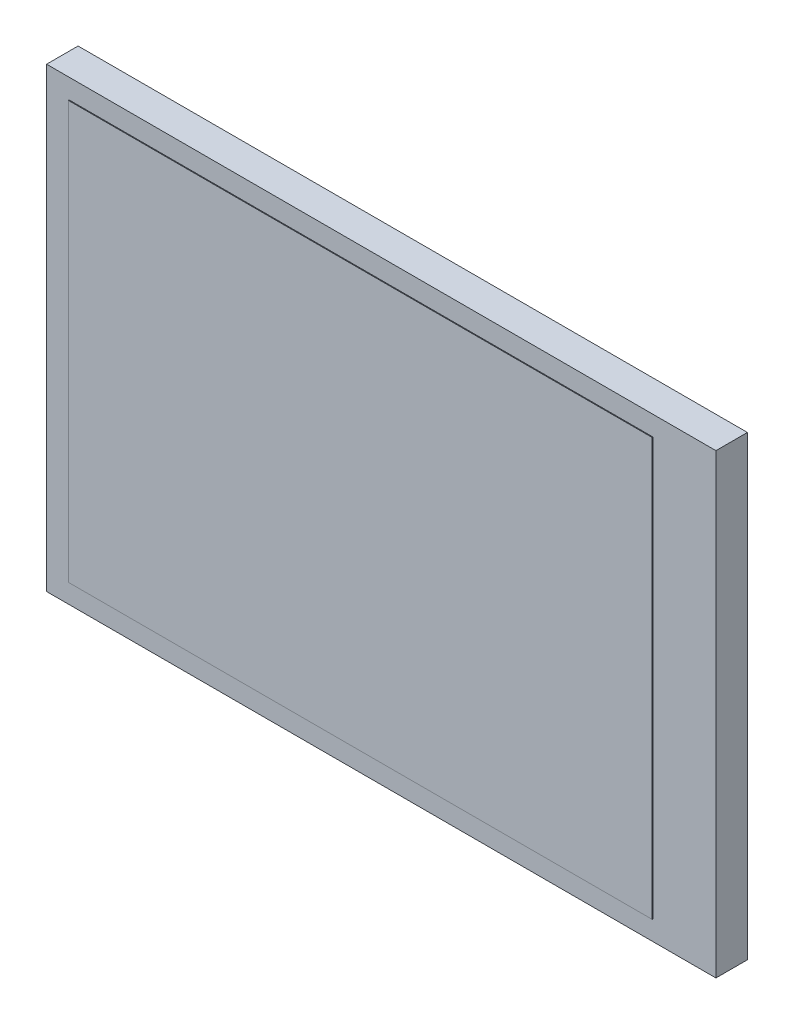
from build123d import *

# Parameters (mm, degrees)
SKETCH1_W           = 85
SKETCH1_H           = 58
BOSS_EXTRUDE1_DEPTH = 4
SKETCH2_W           = 74.144131661
SKETCH2_H           = 53
BOSS_EXTRUDE2_DEPTH = 0.1


with BuildPart() as part:
    # Sketch1 → Boss-Extrude1 (new body)
    with BuildSketch(Plane.XY):
        with Locations((-42.5, 29)):
            Rectangle(SKETCH1_W, SKETCH1_H)
    extrude(amount=BOSS_EXTRUDE1_DEPTH)

    # Sketch2 → Boss-Extrude2 (add)
    with BuildSketch(Plane.XY.offset(4)):
        with Locations((-45.072065831, 29)):
            Rectangle(SKETCH2_W, SKETCH2_H)
    extrude(amount=BOSS_EXTRUDE2_DEPTH)


solid = part.part
